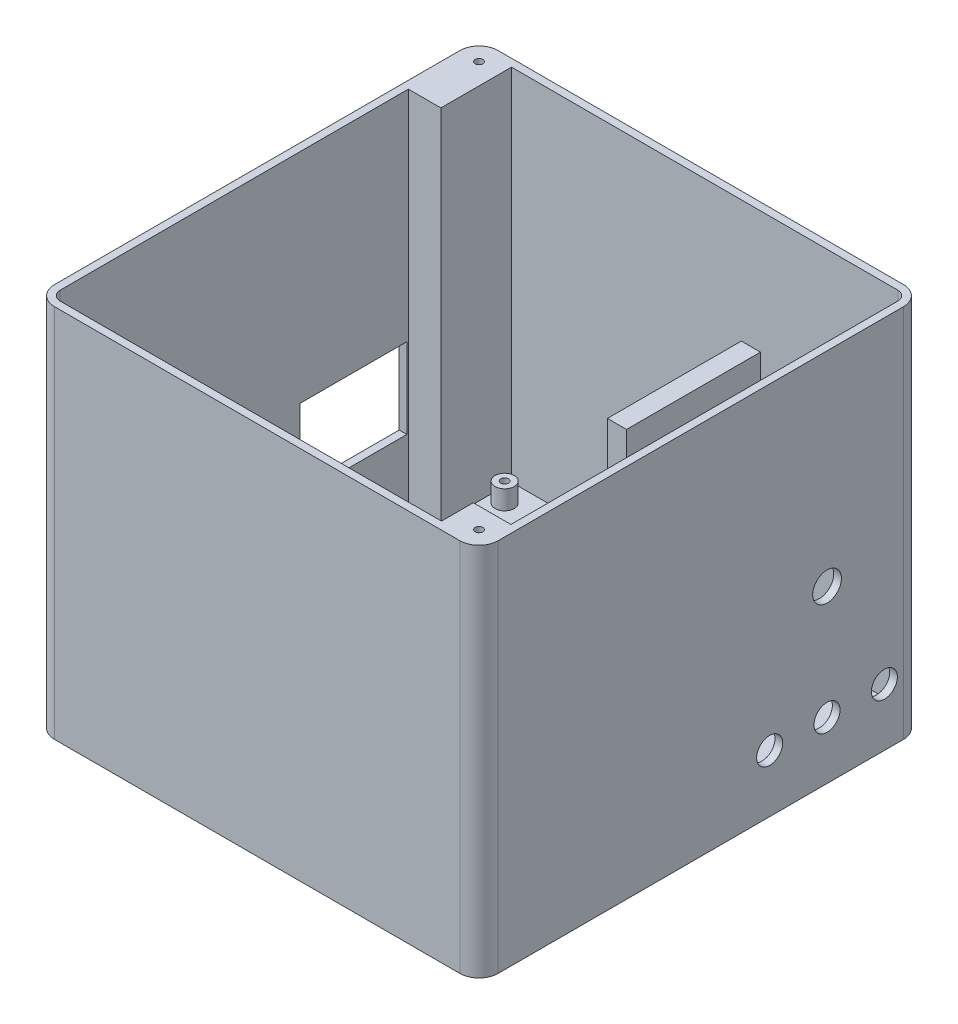
from build123d import *

# Parameters (mm, degrees)
SKETCH3_W            = 116
SKETCH3_H            = 116
SKETCH3_W_2          = 112
SKETCH3_H_2          = 112
EXTRUDE_THIN1_DEPTH  = 98
SKETCH7_W            = 112
SKETCH7_H            = 4
BOSS_EXTRUDE1_DEPTH  = 112
SKETCH16_R           = 2.5
BOSS_EXTRUDE5_DEPTH  = 5
SKETCH17_R           = 1
CUT_EXTRUDE1_DEPTH   = 10
SKETCH24_W           = 28
SKETCH24_H           = 21
CUT_EXTRUDE5_DEPTH   = 3
SKETCH25_R           = 3.4
CUT_EXTRUDE6_DEPTH   = 5
SKETCH26_R           = 2
CUT_EXTRUDE7_DEPTH   = 10
FILLET1_R            = 5
SKETCH28_R           = 1
CUT_EXTRUDE8_DEPTH   = 5
SKETCH29_W           = 17.353065695
SKETCH29_H           = 49.827316315
BOSS_EXTRUDE7_DEPTH  = 62
SKETCH39_W           = 5
SKETCH39_H           = 35.01287547
BOSS_EXTRUDE9_DEPTH  = 62
SKETCH38_R           = 1
CUT_EXTRUDE9_DEPTH   = 10
SKETCH40_W           = 16.841082299
SKETCH40_H           = 8.344585346
BOSS_EXTRUDE10_DEPTH = 32
SKETCH42_W           = 8.507454347
SKETCH42_H           = 18.470083193
BOSS_EXTRUDE11_DEPTH = 94
FILLET3_R            = 2.5
SKETCH44_R           = 1
CUT_EXTRUDE10_DEPTH  = 10
SKETCH49_R           = 3.75
CUT_EXTRUDE11_DEPTH  = 5
CUT_EXTRUDE13_START  = -62
SKETCH53_W           = 7
SKETCH53_H           = 61.127318702
CUT_EXTRUDE13_DEPTH  = 94


with BuildPart() as part:
    # Sketch3 → Extrude-Thin1 (new body)
    with BuildSketch(Plane(origin=(0, 0, 0), x_dir=(1, 0, 0), z_dir=(0, 1, 0))):
        Rectangle(SKETCH3_W, SKETCH3_H)
        Rectangle(SKETCH3_W_2, SKETCH3_H_2, mode=Mode.SUBTRACT)
    extrude(amount=EXTRUDE_THIN1_DEPTH)

    # Sketch7 → Boss-Extrude1 (add)
    with BuildSketch(Plane(origin=(-56, 0, 0), x_dir=(0, 0, -1), z_dir=(1, 0, 0))):
        with Locations((0, 2)):
            Rectangle(SKETCH7_W, SKETCH7_H)
    extrude(amount=BOSS_EXTRUDE1_DEPTH)

    # Sketch16 → Boss-Extrude5 (add)
    with BuildSketch(Plane(origin=(0, 4, 0), x_dir=(1, 0, 0), z_dir=(0, 1, 0))):
        with Locations(Location((-43.663355479, 11.866927151, 0), (0, 0, 90))):
            Circle(SKETCH16_R)
        with Locations(Location((8.336644521, 11.866927151, 0), (0, 0, 90))):
            Circle(SKETCH16_R)
        with Locations(Location((8.336644521, 50.366927151, 0), (0, 0, 90))):
            Circle(SKETCH16_R)
        with Locations(Location((-43.663355479, 50.366927151, 0), (0, 0, 90))):
            Circle(SKETCH16_R)
    extrude(amount=BOSS_EXTRUDE5_DEPTH)

    # Sketch17 → Cut-Extrude1 (cut)
    with BuildSketch(Plane(origin=(0, 9, 0), x_dir=(1, 0, 0), z_dir=(0, 1, 0))):
        with Locations(Location((8.336644521, 11.866927151, 0), (0, 0, 270))):
            Circle(SKETCH17_R)
        with Locations(Location((-43.663355479, 11.866927151, 0), (0, 0, 270))):
            Circle(SKETCH17_R)
        with Locations(Location((-43.663355479, 50.366927151, 0), (0, 0, 270))):
            Circle(SKETCH17_R)
        with Locations(Location((8.336644521, 50.366927151, 0), (0, 0, 270))):
            Circle(SKETCH17_R)
    extrude(amount=-CUT_EXTRUDE1_DEPTH, mode=Mode.SUBTRACT)

    # Sketch24 → Cut-Extrude5 (cut)
    with BuildSketch(Plane.ZY.offset(58)):
        with Locations((-23.128133878, 30.5)):
            Rectangle(SKETCH24_W, SKETCH24_H)
    extrude(amount=-CUT_EXTRUDE5_DEPTH, mode=Mode.SUBTRACT)

    # Sketch25 → Cut-Extrude6 (cut)
    with BuildSketch(Plane(origin=(58, 0, 0), x_dir=(0, 0, -1), z_dir=(1, 0, 0))):
        with Locations((48, 15)):
            Circle(SKETCH25_R)
        with Locations((33, 15)):
            Circle(SKETCH25_R)
        with Locations((18, 15)):
            Circle(SKETCH25_R)
    extrude(amount=-CUT_EXTRUDE6_DEPTH, mode=Mode.SUBTRACT)

    # Sketch26 → Cut-Extrude7 (cut)
    with BuildSketch(Plane.ZY.offset(58)):
        with Locations((-42.7670651, 30.630544298)):
            Circle(SKETCH26_R)
        with Locations((-2.7670651, 30.630544298)):
            Circle(SKETCH26_R)
    extrude(amount=-CUT_EXTRUDE7_DEPTH, mode=Mode.SUBTRACT)

    # Fillet1
    fillet1_edges = [part.edges().sort_by_distance(p)[0] for p in [
        (-58, 49, -58),
        (58, 49, -58),
        (58, 49, 58),
        (-58, 49, 58),
    ]]
    fillet(fillet1_edges, radius=FILLET1_R)

    # Sketch28 → Cut-Extrude8 (cut)
    with BuildSketch(Plane.XZ):
        with Locations(Location((-53.841082299, 54.831187122, 0), (0, 0, 270))):
            Circle(SKETCH28_R)
        with Locations(Location((-43.841082299, 54.831187122, 0), (0, 0, 270))):
            Circle(SKETCH28_R)
        with Locations(Location((-33.841082299, 54.831187122, 0), (0, 0, 270))):
            Circle(SKETCH28_R)
        with Locations(Location((-23.841082299, 54.831187122, 0), (0, 0, 270))):
            Circle(SKETCH28_R)
        with Locations(Location((-13.841082299, 54.831187122, 0), (0, 0, 270))):
            Circle(SKETCH28_R)
        with Locations(Location((-3.841082299, 54.831187122, 0), (0, 0, 270))):
            Circle(SKETCH28_R)
        with Locations(Location((6.158917701, 54.831187122, 0), (0, 0, 270))):
            Circle(SKETCH28_R)
        with Locations(Location((16.158917701, 54.831187122, 0), (0, 0, 270))):
            Circle(SKETCH28_R)
        with Locations(Location((26.158917701, 54.831187122, 0), (0, 0, 270))):
            Circle(SKETCH28_R)
        with Locations(Location((36.158917701, 54.831187122, 0), (0, 0, 270))):
            Circle(SKETCH28_R)
        with Locations(Location((-43.841082299, 44.831187122, 0), (0, 0, 270))):
            Circle(SKETCH28_R)
        with Locations(Location((-33.841082299, 44.831187122, 0), (0, 0, 270))):
            Circle(SKETCH28_R)
        with Locations(Location((-23.841082299, 44.831187122, 0), (0, 0, 270))):
            Circle(SKETCH28_R)
        with Locations(Location((-13.841082299, 44.831187122, 0), (0, 0, 270))):
            Circle(SKETCH28_R)
        with Locations(Location((-3.841082299, 44.831187122, 0), (0, 0, 270))):
            Circle(SKETCH28_R)
        with Locations(Location((6.158917701, 44.831187122, 0), (0, 0, 270))):
            Circle(SKETCH28_R)
        with Locations(Location((16.158917701, 44.831187122, 0), (0, 0, 270))):
            Circle(SKETCH28_R)
        with Locations(Location((26.158917701, 44.831187122, 0), (0, 0, 270))):
            Circle(SKETCH28_R)
        with Locations(Location((36.158917701, 44.831187122, 0), (0, 0, 270))):
            Circle(SKETCH28_R)
        with Locations(Location((-43.841082299, 34.831187122, 0), (0, 0, 270))):
            Circle(SKETCH28_R)
        with Locations(Location((-33.841082299, 34.831187122, 0), (0, 0, 270))):
            Circle(SKETCH28_R)
        with Locations(Location((-23.841082299, 34.831187122, 0), (0, 0, 270))):
            Circle(SKETCH28_R)
        with Locations(Location((-13.841082299, 34.831187122, 0), (0, 0, 270))):
            Circle(SKETCH28_R)
        with Locations(Location((-3.841082299, 34.831187122, 0), (0, 0, 270))):
            Circle(SKETCH28_R)
        with Locations(Location((6.158917701, 34.831187122, 0), (0, 0, 270))):
            Circle(SKETCH28_R)
        with Locations(Location((16.158917701, 34.831187122, 0), (0, 0, 270))):
            Circle(SKETCH28_R)
        with Locations(Location((26.158917701, 34.831187122, 0), (0, 0, 270))):
            Circle(SKETCH28_R)
        with Locations(Location((36.158917701, 34.831187122, 0), (0, 0, 270))):
            Circle(SKETCH28_R)
        with Locations(Location((-43.841082299, 24.831187122, 0), (0, 0, 270))):
            Circle(SKETCH28_R)
        with Locations(Location((-33.841082299, 24.831187122, 0), (0, 0, 270))):
            Circle(SKETCH28_R)
        with Locations(Location((-23.841082299, 24.831187122, 0), (0, 0, 270))):
            Circle(SKETCH28_R)
        with Locations(Location((-13.841082299, 24.831187122, 0), (0, 0, 270))):
            Circle(SKETCH28_R)
        with Locations(Location((-3.841082299, 24.831187122, 0), (0, 0, 270))):
            Circle(SKETCH28_R)
        with Locations(Location((6.158917701, 24.831187122, 0), (0, 0, 270))):
            Circle(SKETCH28_R)
        with Locations(Location((16.158917701, 24.831187122, 0), (0, 0, 270))):
            Circle(SKETCH28_R)
        with Locations(Location((26.158917701, 24.831187122, 0), (0, 0, 270))):
            Circle(SKETCH28_R)
        with Locations(Location((36.158917701, 24.831187122, 0), (0, 0, 270))):
            Circle(SKETCH28_R)
        with Locations(Location((-43.841082299, 14.831187122, 0), (0, 0, 270))):
            Circle(SKETCH28_R)
        with Locations(Location((-33.841082299, 14.831187122, 0), (0, 0, 270))):
            Circle(SKETCH28_R)
        with Locations(Location((-23.841082299, 14.831187122, 0), (0, 0, 270))):
            Circle(SKETCH28_R)
        with Locations(Location((-13.841082299, 14.831187122, 0), (0, 0, 270))):
            Circle(SKETCH28_R)
        with Locations(Location((-3.841082299, 14.831187122, 0), (0, 0, 270))):
            Circle(SKETCH28_R)
        with Locations(Location((6.158917701, 14.831187122, 0), (0, 0, 270))):
            Circle(SKETCH28_R)
        with Locations(Location((16.158917701, 14.831187122, 0), (0, 0, 270))):
            Circle(SKETCH28_R)
        with Locations(Location((26.158917701, 14.831187122, 0), (0, 0, 270))):
            Circle(SKETCH28_R)
        with Locations(Location((36.158917701, 14.831187122, 0), (0, 0, 270))):
            Circle(SKETCH28_R)
        with Locations(Location((-43.841082299, 4.831187122, 0), (0, 0, 270))):
            Circle(SKETCH28_R)
        with Locations(Location((-33.841082299, 4.831187122, 0), (0, 0, 270))):
            Circle(SKETCH28_R)
        with Locations(Location((-23.841082299, 4.831187122, 0), (0, 0, 270))):
            Circle(SKETCH28_R)
        with Locations(Location((-13.841082299, 4.831187122, 0), (0, 0, 270))):
            Circle(SKETCH28_R)
        with Locations(Location((-3.841082299, 4.831187122, 0), (0, 0, 270))):
            Circle(SKETCH28_R)
        with Locations(Location((6.158917701, 4.831187122, 0), (0, 0, 270))):
            Circle(SKETCH28_R)
        with Locations(Location((16.158917701, 4.831187122, 0), (0, 0, 270))):
            Circle(SKETCH28_R)
        with Locations(Location((26.158917701, 4.831187122, 0), (0, 0, 270))):
            Circle(SKETCH28_R)
        with Locations(Location((36.158917701, 4.831187122, 0), (0, 0, 270))):
            Circle(SKETCH28_R)
        with Locations(Location((-43.841082299, -5.168812878, 0), (0, 0, 270))):
            Circle(SKETCH28_R)
        with Locations(Location((-33.841082299, -5.168812878, 0), (0, 0, 270))):
            Circle(SKETCH28_R)
        with Locations(Location((-23.841082299, -5.168812878, 0), (0, 0, 270))):
            Circle(SKETCH28_R)
        with Locations(Location((-13.841082299, -5.168812878, 0), (0, 0, 270))):
            Circle(SKETCH28_R)
        with Locations(Location((-3.841082299, -5.168812878, 0), (0, 0, 270))):
            Circle(SKETCH28_R)
        with Locations(Location((6.158917701, -5.168812878, 0), (0, 0, 270))):
            Circle(SKETCH28_R)
        with Locations(Location((16.158917701, -5.168812878, 0), (0, 0, 270))):
            Circle(SKETCH28_R)
        with Locations(Location((26.158917701, -5.168812878, 0), (0, 0, 270))):
            Circle(SKETCH28_R)
        with Locations(Location((36.158917701, -5.168812878, 0), (0, 0, 270))):
            Circle(SKETCH28_R)
        with Locations(Location((-53.841082299, 44.831187122, 0), (0, 0, 270))):
            Circle(SKETCH28_R)
        with Locations(Location((-53.841082299, 34.831187122, 0), (0, 0, 270))):
            Circle(SKETCH28_R)
        with Locations(Location((-53.841082299, 24.831187122, 0), (0, 0, 270))):
            Circle(SKETCH28_R)
        with Locations(Location((-53.841082299, 14.831187122, 0), (0, 0, 270))):
            Circle(SKETCH28_R)
        with Locations(Location((-53.841082299, 4.831187122, 0), (0, 0, 270))):
            Circle(SKETCH28_R)
        with Locations(Location((-53.841082299, -5.168812878, 0), (0, 0, 270))):
            Circle(SKETCH28_R)
    extrude(amount=-CUT_EXTRUDE8_DEPTH, mode=Mode.SUBTRACT)

    # Sketch29 → Boss-Extrude7 (add)
    with BuildSketch(Plane(origin=(0, 4, 0), x_dir=(1, 0, 0), z_dir=(0, 1, 0))):
        Polygon((39.158917701, 5.168812878), (30.002262369, 5.168812878), (30.002262369, 9.795410455), (53.385207621, 9.795410455), (53.385207621, -6.027944896), (39.158917701, -6.027944896), align=None)
        with Locations((47.835450549, -31.086341843)):
            Rectangle(SKETCH29_W, SKETCH29_H)
    extrude(amount=BOSS_EXTRUDE7_DEPTH)

    # Sketch39 → Boss-Extrude9 (add)
    with BuildSketch(Plane(origin=(0, 4, 0), x_dir=(1, 0, 0), z_dir=(0, 1, 0))):
        with Locations((15.092274718, 38.493562265)):
            Rectangle(SKETCH39_W, SKETCH39_H)
    extrude(amount=BOSS_EXTRUDE9_DEPTH)

    # Sketch38 → Cut-Extrude9 (cut)
    with BuildSketch(Plane(origin=(0, 66, 0), x_dir=(1, 0, 0), z_dir=(0, 1, 0))):
        with Locations(Location((54.2, -43.7, 0), (0, 0, 270))):
            Circle(SKETCH38_R)
    extrude(amount=-CUT_EXTRUDE9_DEPTH, mode=Mode.SUBTRACT)

    # Sketch40 → Boss-Extrude10 (add)
    with BuildSketch(Plane(origin=(0, 66, 0), x_dir=(1, 0, 0), z_dir=(0, 1, 0))):
        with Locations((47.579458851, -51.827707327)):
            Rectangle(SKETCH40_W, SKETCH40_H)
    extrude(amount=BOSS_EXTRUDE10_DEPTH)

    # Sketch42 → Boss-Extrude11 (add)
    with BuildSketch(Plane(origin=(0, 4, 0), x_dir=(1, 0, 0), z_dir=(0, 1, 0))):
        with Locations((-51.746272827, 46.764958404)):
            Rectangle(SKETCH42_W, SKETCH42_H)
    extrude(amount=BOSS_EXTRUDE11_DEPTH)

    # Fillet3
    fillet3_edges = [part.edges().sort_by_distance(p)[0] for p in [
        (-56, 51, 56),
        (56, 51, -56),
    ]]
    fillet(fillet3_edges, radius=FILLET3_R)

    # Sketch44 → Cut-Extrude10 (cut)
    with BuildSketch(Plane(origin=(0, 98, 0), x_dir=(1, 0, 0), z_dir=(0, 1, 0))):
        with Locations(Location((53, -53, 0), (0, 0, 270))):
            Circle(SKETCH44_R)
        with Locations(Location((-53, 53, 0), (0, 0, 270))):
            Circle(SKETCH44_R)
    extrude(amount=-CUT_EXTRUDE10_DEPTH, mode=Mode.SUBTRACT)

    # Sketch49 → Cut-Extrude11 (cut)
    with BuildSketch(Plane(origin=(58, 0, 0), x_dir=(0, 0, -1), z_dir=(1, 0, 0))):
        with Locations((33.008770656, 44.626515077)):
            Circle(SKETCH49_R)
    extrude(amount=-CUT_EXTRUDE11_DEPTH, mode=Mode.SUBTRACT)

    # Sketch53 → Cut-Extrude13 (cut)
    with BuildSketch(Plane(origin=(0, 66, 0), x_dir=(1, 0, 0), z_dir=(0, 1, 0)).offset(CUT_EXTRUDE13_START)):
        with Locations((42.658917701, -25.394846473)):
            Rectangle(SKETCH53_W, SKETCH53_H)
    extrude(amount=CUT_EXTRUDE13_DEPTH, mode=Mode.SUBTRACT)


solid = part.part
